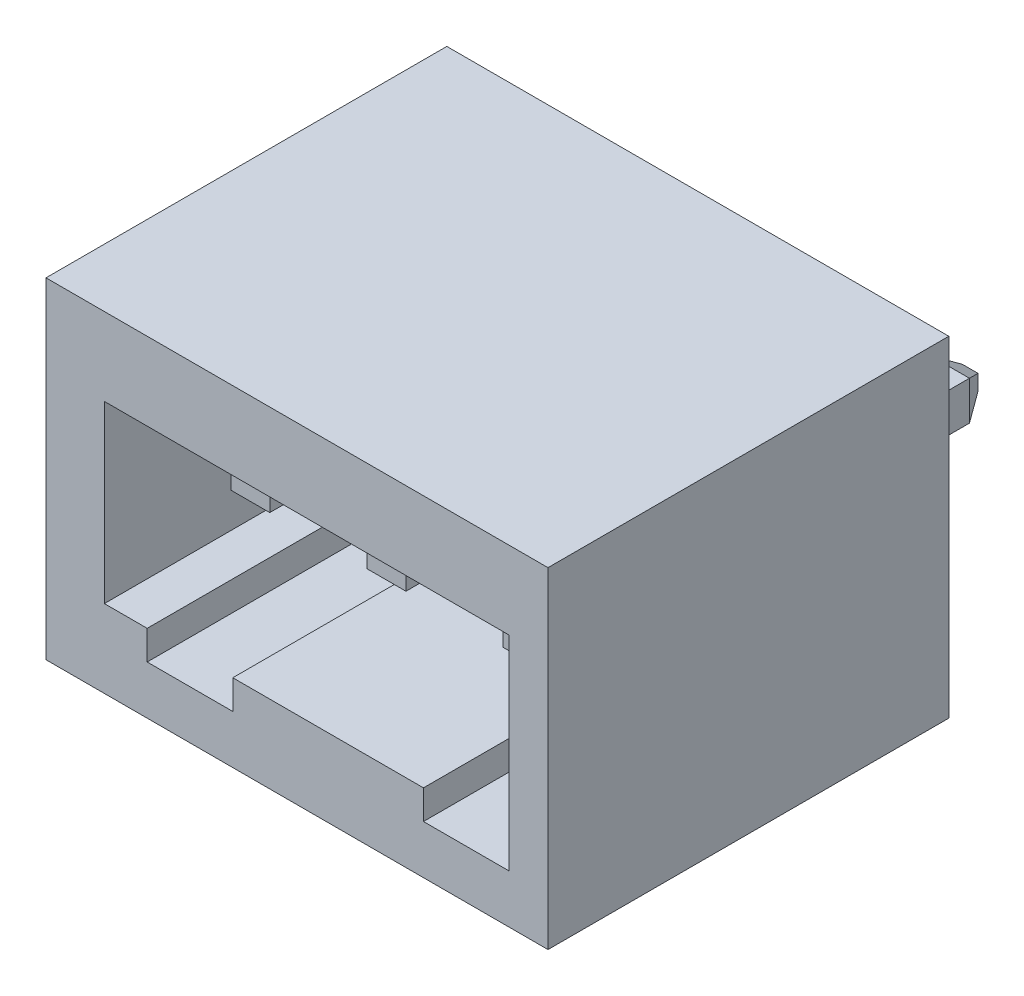
from build123d import *

# Parameters (mm, degrees)
EXTRUDE_1_DEPTH            = 8
EXTRUDE_1_DEPTH_BACK       = 3.5
SKETCH_1_W                 = 1
SKETCH_1_H                 = 1
CHAMFER_1_SIZE             = 0.3
CHAMFER_1_SIZE2            = 0.519615242
PATTERN_LINEAR_1_COUNT     = 3
PATTERN_LINEAR_1_PITCH     = 3.5
SKETCH_3_W                 = 12.9
SKETCH_3_H                 = 8.5
EXTRUDE_2_DEPTH            = 10.3
SHELL_1_T                  = -2
SHELL_1_THICKNESS_2_FACE_W = 4.5
SHELL_1_THICKNESS_2_FACE_H = 8.3
SHELL_1_THICKNESS_2_DEPTH  = 0.5
SHELL_1_THICKNESS_3_FACE_W = 4.5
SHELL_1_THICKNESS_3_FACE_H = 8.3
SHELL_1_THICKNESS_3_DEPTH  = 1
SHELL_1_THICKNESS_4_FACE_W = 10.4
SHELL_1_THICKNESS_4_FACE_H = 4.5
SHELL_1_THICKNESS_4_DEPTH  = 0.5
SKETCH_4_W                 = 2.2
SKETCH_4_H                 = 0.75
CUT_EXTRUDE_1_DEPTH        = 8.8


with BuildPart() as part:
    # Эскиз1 → Бобышка-Вытянуть1 (new, two sides: drawn at the far end of the back side and taken through both)
    with BuildSketch(Plane.XY.offset(-EXTRUDE_1_DEPTH_BACK)):
        with Locations((-3.5, 0)):
            Rectangle(SKETCH_1_W, SKETCH_1_H)
    extrude(amount=EXTRUDE_1_DEPTH + EXTRUDE_1_DEPTH_BACK)

    # Фаска1
    chamfer_1_edges = [part.edges().sort_by_distance(p)[0] for p in [
        (-4, 0, -3.5),
        (-3.5, -0.5, -3.5),
        (-3, 0, -3.5),
        (-3.5, 0.5, -3.5),
    ]]
    chamfer_1_side = [part.faces().sort_by_distance(p)[0] for p in [
        (-3.5, 0, -3.5),
    ]]
    chamfer(chamfer_1_edges, length=CHAMFER_1_SIZE, length2=CHAMFER_1_SIZE2, reference=chamfer_1_side[0])


with BuildPart() as pattern_linear_1_1:
    # Линейный массив1: pattern copy
    add(part.part.moved(Location(Vector(1, 0, 0) * (1 * PATTERN_LINEAR_1_PITCH))))


with BuildPart() as pattern_linear_1_2:
    # Линейный массив1: pattern copy
    add(part.part.moved(Location(Vector(1, 0, 0) * (2 * PATTERN_LINEAR_1_PITCH))))


with BuildPart() as body_4:
    # Эскиз3 → Бобышка-Вытянуть2 (new body)
    with BuildSketch(Plane.XY):
        with Locations((0, -0.1)):
            Rectangle(SKETCH_3_W, SKETCH_3_H)
    extrude(amount=EXTRUDE_2_DEPTH)

    # Оболочка1
    shell_1_openings = [body_4.faces().sort_by_distance(p)[0] for p in [
        (0, -0.1, 10.3),
    ]]
    offset(amount=SHELL_1_T, openings=shell_1_openings, kind=Kind.INTERSECTION)

    # Оболочка1 thickness 2 face (on inner face of the shell) → Оболочка1 thickness 2 (cut)
    with BuildSketch(Plane(origin=(-4.45, -0.1, 6.15), x_dir=(0, -1, 0), z_dir=(-1, 0, 0))):
        Rectangle(SHELL_1_THICKNESS_2_FACE_W, SHELL_1_THICKNESS_2_FACE_H)
    extrude(amount=SHELL_1_THICKNESS_2_DEPTH, mode=Mode.SUBTRACT)

    # Оболочка1 thickness 3 face (on inner face of the shell) → Оболочка1 thickness 3 (cut)
    with BuildSketch(Plane(origin=(4.45, -0.1, 6.15), x_dir=(0, 1, 0), z_dir=(1, 0, 0))):
        Rectangle(SHELL_1_THICKNESS_3_FACE_W, SHELL_1_THICKNESS_3_FACE_H)
    extrude(amount=SHELL_1_THICKNESS_3_DEPTH, mode=Mode.SUBTRACT)

    # Оболочка1 thickness 4 face (on inner face of the shell) → Оболочка1 thickness 4 (cut)
    with BuildSketch(Plane(origin=(0.25, -0.1, 2), x_dir=(-1, 0, 0), z_dir=(0, 0, -1))):
        Rectangle(SHELL_1_THICKNESS_4_FACE_W, SHELL_1_THICKNESS_4_FACE_H)
    extrude(amount=SHELL_1_THICKNESS_4_DEPTH, mode=Mode.SUBTRACT)

    # Эскиз4 → Вырез-Вытянуть1 (cut)
    with BuildSketch(Plane.XY.offset(10.3)):
        with Locations((-2.75, -2.725)):
            Rectangle(SKETCH_4_W, SKETCH_4_H)
        with Locations((4.35, -2.725)):
            Rectangle(SKETCH_4_W, SKETCH_4_H)
    extrude(amount=-CUT_EXTRUDE_1_DEPTH, mode=Mode.SUBTRACT)


solid = Compound([part.part, pattern_linear_1_1.part, pattern_linear_1_2.part, body_4.part])
